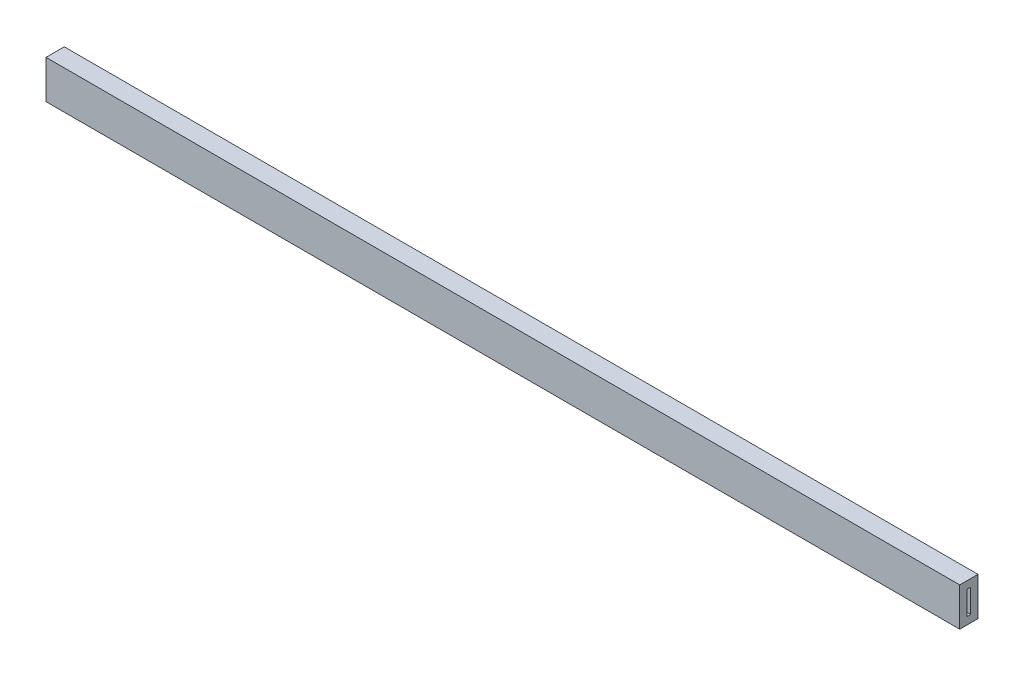
from build123d import *

# Parameters (mm, degrees)
SKETCH1_W           = 15
SKETCH1_H           = 31.5
SKETCH1_W_2         = 3
SKETCH1_H_2         = 19.5
BOSS_EXTRUDE1_DEPTH = 750


with BuildPart() as part:
    # Sketch1 → Boss-Extrude1 (new body)
    with BuildSketch(Plane(origin=(0, 0, 0), x_dir=(0, 0, -1), z_dir=(1, 0, 0))):
        Rectangle(SKETCH1_W, SKETCH1_H)
        Rectangle(SKETCH1_W_2, SKETCH1_H_2, mode=Mode.SUBTRACT)
    extrude(amount=BOSS_EXTRUDE1_DEPTH)


solid = part.part
